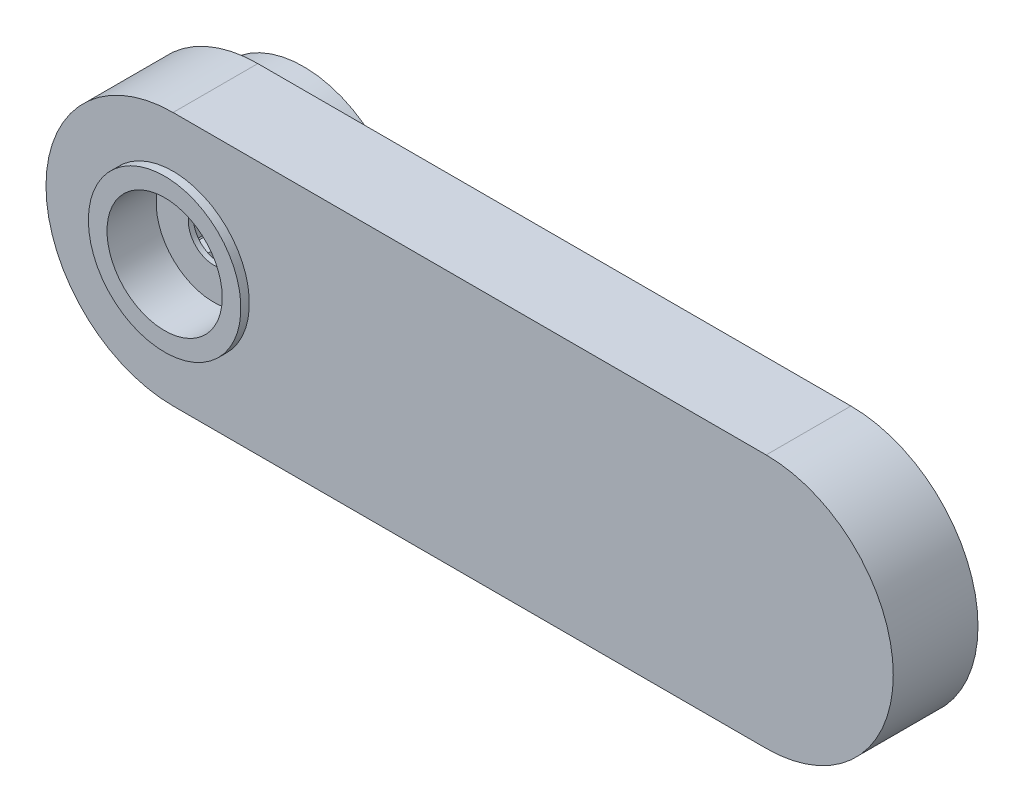
from build123d import *

# Parameters (mm, degrees)
EXTRUDE_1_DEPTH                = 5
SKETCH_2_R                     = 6
EXTRUDE_2_DEPTH                = 2.7
CUT_EXTRUDE_1_DEPTH            = 5
SKETCH_4_W                     = 4.5
SKETCH_4_H                     = 0.5
HOLE_WIZARD_M2_5_1_D           = 3
HOLE_WIZARD_M2_5_1_DEPTH       = 8.2
HOLE_WIZARD_M2_5_1_CBORE_D     = 6.8
HOLE_WIZARD_M2_5_1_CBORE_DEPTH = 2.9


with BuildPart() as part:
    # 스케치1 → 보스-돌출1 (new body)
    with BuildSketch(Plane(origin=(0, 0, 0), x_dir=(-1, 0, 0), z_dir=(0, 0, -1))):
        with BuildLine():
            Line((0, -7.5), (-35, -7.5))
            ThreePointArc((-35, -7.5), (-42.5, 0), (-35, 7.5))
            Line((-35, 7.5), (0, 7.5))
            ThreePointArc((0, 7.5), (7.5, 0), (0, -7.5))
        make_face()
    extrude(amount=-EXTRUDE_1_DEPTH)

    # 스케치2 → 보스-돌출2 (add)
    with BuildSketch(Plane(origin=(0, 0, 0), x_dir=(-1, 0, 0), z_dir=(0, 0, -1))):
        with Locations(Location((0, 0, 0), (0, 0, 180))):
            Circle(SKETCH_2_R)
    extrude(amount=EXTRUDE_2_DEPTH)

    # 스케치3 → 컷-돌출1 (cut)
    with BuildSketch(Plane(origin=(0, 0, -2.7), x_dir=(-1, 0, 0), z_dir=(0, 0, -1))):
        with BuildLine():
            Line((-0.820496547, 3.65913725), (-1.32189409, 2.969022737))
            Line((-1.32189409, 2.969022737), (-2.170249561, 3.05818849))
            ThreePointArc((-2.170249561, 3.05818849), (-2.204194696, 3.033813729), (-2.237866095, 3.009062203))
            Line((-2.237866095, 3.009062203), (-2.415220683, 2.174674471))
            Line((-2.415220683, 2.174674471), (-3.226498949, 1.911074183))
            ThreePointArc((-3.226498949, 1.911074183), (-3.247595264, 1.875), (-3.268288265, 1.838692964))
            Line((-3.268288265, 1.838692964), (-3.090933678, 1.004305232))
            Line((-3.090933678, 1.004305232), (-3.724857357, 0.433517788))
            ThreePointArc((-3.724857357, 0.433517788), (-3.729457108, 0.391981737), (-3.733593703, 0.350397007))
            Line((-3.733593703, 0.350397007), (-3.23219616, -0.339717506))
            Line((-3.23219616, -0.339717506), (-3.579154088, -1.118997772))
            ThreePointArc((-3.579154088, -1.118997772), (-3.566461936, -1.158813729), (-3.55332687, -1.198485775))
            Line((-3.55332687, -1.198485775), (-2.814582562, -1.625))
            Line((-2.814582562, -1.625), (-2.814582562, -2.47802845))
            ThreePointArc((-2.814582562, -2.47802845), (-2.786793096, -2.509239774), (-2.758657541, -2.540139479))
            Line((-2.758657541, -2.540139479), (-1.91030207, -2.629305232))
            Line((-1.91030207, -2.629305232), (-1.563344142, -3.408585498))
            ThreePointArc((-1.563344142, -3.408585498), (-1.525262412, -3.425795466), (-1.486991261, -3.44257999))
            Line((-1.486991261, -3.44257999), (-0.675712995, -3.178979702))
            Line((-0.675712995, -3.178979702), (-0.041789316, -3.749767147))
            ThreePointArc((-0.041789316, -3.749767147), (0, -3.75), (0.041789316, -3.749767147))
            Line((0.041789316, -3.749767147), (0.675712995, -3.178979702))
            Line((0.675712995, -3.178979702), (1.486991261, -3.44257999))
            ThreePointArc((1.486991261, -3.44257999), (1.525262412, -3.425795466), (1.563344142, -3.408585498))
            Line((1.563344142, -3.408585498), (1.91030207, -2.629305232))
            Line((1.91030207, -2.629305232), (2.758657541, -2.540139479))
            ThreePointArc((2.758657541, -2.540139479), (2.786793096, -2.509239774), (2.814582562, -2.47802845))
            Line((2.814582562, -2.47802845), (2.814582562, -1.625))
            Line((2.814582562, -1.625), (3.55332687, -1.198485775))
            ThreePointArc((3.55332687, -1.198485775), (3.566461936, -1.158813729), (3.579154088, -1.118997772))
            Line((3.579154088, -1.118997772), (3.23219616, -0.339717506))
            Line((3.23219616, -0.339717506), (3.733593703, 0.350397007))
            ThreePointArc((3.733593703, 0.350397007), (3.729457108, 0.391981737), (3.724857357, 0.433517788))
            Line((3.724857357, 0.433517788), (3.090933678, 1.004305232))
            Line((3.090933678, 1.004305232), (3.268288265, 1.838692964))
            ThreePointArc((3.268288265, 1.838692964), (3.247595264, 1.875), (3.226498949, 1.911074183))
            Line((3.226498949, 1.911074183), (2.415220683, 2.174674471))
            Line((2.415220683, 2.174674471), (2.237866095, 3.009062203))
            ThreePointArc((2.237866095, 3.009062203), (2.204194696, 3.033813729), (2.170249561, 3.05818849))
            Line((2.170249561, 3.05818849), (1.32189409, 2.969022737))
            Line((1.32189409, 2.969022737), (0.820496547, 3.65913725))
            ThreePointArc((0.820496547, 3.65913725), (0.779668841, 3.668053503), (0.738744308, 3.676514225))
            Line((0.738744308, 3.676514225), (0, 3.25))
            Line((0, 3.25), (-0.738744308, 3.676514225))
            ThreePointArc((-0.738744308, 3.676514225), (-0.779668841, 3.668053503), (-0.820496547, 3.65913725))
        make_face()
    extrude(amount=-CUT_EXTRUDE_1_DEPTH, mode=Mode.SUBTRACT)

    # 스케치4 → 회전1 (revolve)
    with BuildSketch(Plane.XZ, mode=Mode.PRIVATE) as revolve_1_sk:
        with Locations((2.25, 5.25)):
            Rectangle(SKETCH_4_W, SKETCH_4_H)
    revolve(revolve_1_sk.sketch.rotate(Axis((0, 0, 5.5), (0, 0, -1)), 180), axis=Axis((0, 0, 5.5), (0, 0, -1)))

    # M2.5 육각 머리 작은 나사용 카운터보어1
    with Locations(Plane.XY.offset(5.5)):
        with Locations((0, 0)):
            CounterBoreHole(HOLE_WIZARD_M2_5_1_D / 2, HOLE_WIZARD_M2_5_1_CBORE_D / 2, HOLE_WIZARD_M2_5_1_CBORE_DEPTH, depth=HOLE_WIZARD_M2_5_1_DEPTH)


solid = part.part
